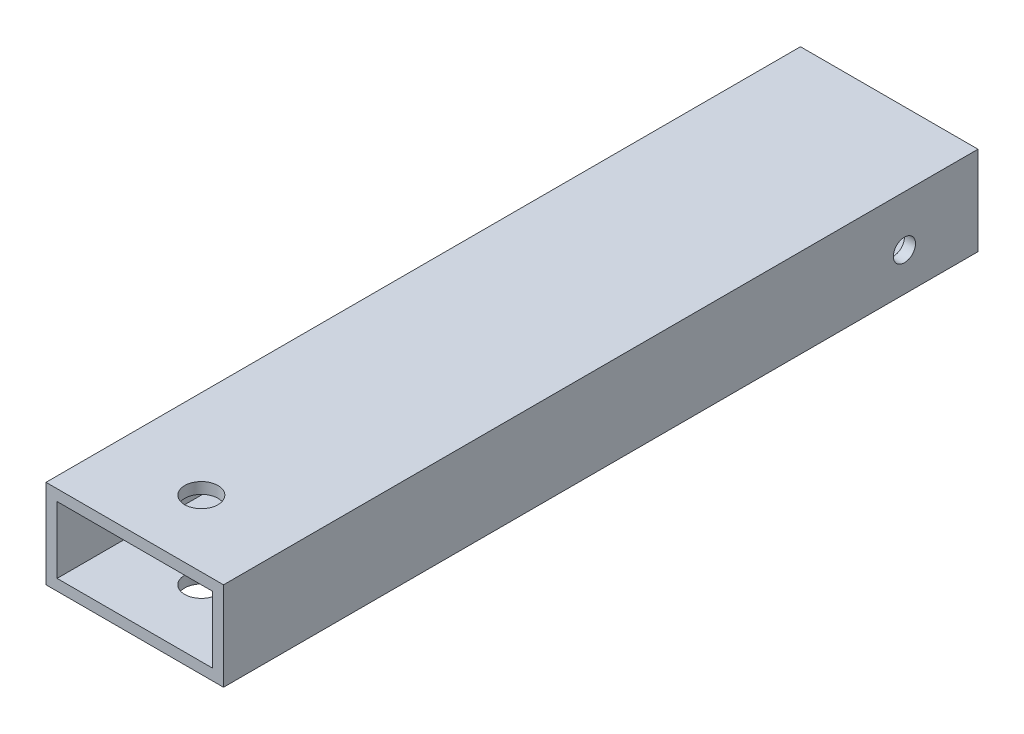
from build123d import *

# Parameters (mm, degrees)
SKETCH1_W           = 50.8
SKETCH1_H           = 25.4
SKETCH1_W_2         = 44.45
SKETCH1_H_2         = 19.05
BOSS_EXTRUDE1_DEPTH = 304.8
SKETCH2_R           = 4.7625
CUT_EXTRUDE1_DEPTH  = 307.909367729
SKETCH3_R           = 3.175
CUT_EXTRUDE2_DEPTH  = 310.265209812
SKETCH4_W           = 50.8
SKETCH4_H           = 25.4
CUT_EXTRUDE3_DEPTH  = 88.9


with BuildPart() as part:
    # Sketch1 → Boss-Extrude1 (new body)
    with BuildSketch(Plane.XY):
        Rectangle(SKETCH1_W, SKETCH1_H)
        Rectangle(SKETCH1_W_2, SKETCH1_H_2, mode=Mode.SUBTRACT)
    extrude(amount=BOSS_EXTRUDE1_DEPTH)

    # Sketch2 → Cut-Extrude1 (cut, through all)
    with BuildSketch(Plane(origin=(0, 12.7, 0), x_dir=(1, 0, 0), z_dir=(0, 1, 0))):
        with Locations(Location((0, -285.75, 0), (0, 0, 270))):
            Circle(SKETCH2_R)
    extrude(amount=-CUT_EXTRUDE1_DEPTH, mode=Mode.SUBTRACT)

    # Sketch3 → Cut-Extrude2 (cut, through all)
    with BuildSketch(Plane.ZY.offset(25.4)):
        with Locations((109.947638526, -1.739817444)):
            Circle(SKETCH3_R)
    extrude(amount=-CUT_EXTRUDE2_DEPTH, mode=Mode.SUBTRACT)

    # Sketch4 → Cut-Extrude3 (cut)
    with BuildSketch(Plane(origin=(0, 0, 0), x_dir=(-1, 0, 0), z_dir=(0, 0, -1))):
        Rectangle(SKETCH4_W, SKETCH4_H)
    extrude(amount=-CUT_EXTRUDE3_DEPTH, mode=Mode.SUBTRACT)


solid = part.part
